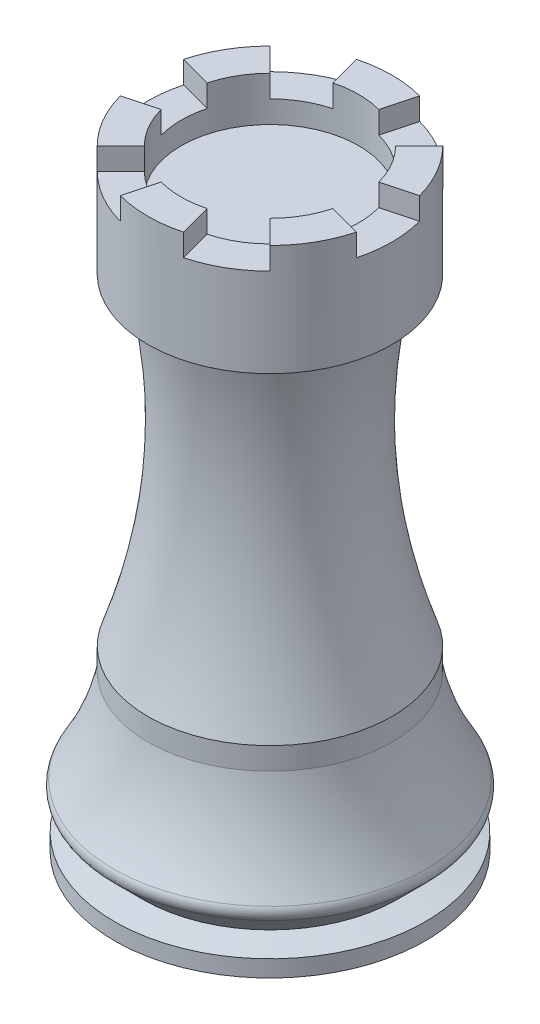
from build123d import *

# Parameters (mm, degrees)
FILLET1_R          = 1
SKETCH2_R          = 8
CUT_EXTRUDE1_DEPTH = 4
SKETCH3_W          = 3
SKETCH3_H          = 2
CUT_REVOLVE1_ANGLE = 30
CIRPATTERN1_COUNT  = 6


with BuildPart() as part:
    # Sketch1 → Revolve1 (revolve)
    with BuildSketch(Plane.XY, mode=Mode.PRIVATE) as revolve1_sk:
        with BuildLine():
            Line((0, 0), (14, 0))
            Line((14, 0), (14, 1.5))
            Line((14, 1.5), (11.449688693, 1.949688693))
            Line((11.449688693, 1.949688693), (14.5, 5))
            add(Edge.make_bspline(
                [(11, 14), (11.868897118, 9.149631339), (14.5, 5)],
                knots=[0, 0, 0, 1, 1, 1], degree=2))
            Line((11, 14), (11, 16))
            add(Edge.make_bspline(
                [(9, 44), (6.119153374, 30.160071278), (11, 16)],
                knots=[0, 0, 0, 1, 1, 1], degree=2))
            Line((9, 44), (11, 45))
            Line((11, 45), (11, 55))
            Line((11, 55), (0, 55))
            Line((0, 55), (0, 0))
        make_face()
    revolve(revolve1_sk.sketch.rotate(Axis((0, 55, 0), (0, -1, 0)), 180), axis=Axis((0, 55, 0), (0, -1, 0)))

    # Fillet1
    fillet1_edges = [part.edges().sort_by_distance(p)[0] for p in [
        (14.5, 5, 0),
    ]]
    fillet(fillet1_edges, radius=FILLET1_R)

    # Sketch2 → Cut-Extrude1 (cut)
    with BuildSketch(Plane(origin=(0, 55, 0), x_dir=(1, 0, 0), z_dir=(0, 1, 0))):
        with Locations(Location((0, 0, 0), (0, 0, 180))):
            Circle(SKETCH2_R)
    extrude(amount=-CUT_EXTRUDE1_DEPTH, mode=Mode.SUBTRACT)

    # Sketch3 → Cut-Revolve1 (revolve, symmetric, cut)
    with BuildSketch(Plane.XY) as cut_revolve1_sk:
        with Locations((9.5, 54)):
            Rectangle(SKETCH3_W, SKETCH3_H)
    cut_revolve1 = revolve(axis=Axis((0, 0, 0), (0, 1, 0)), revolution_arc=CUT_REVOLVE1_ANGLE / 2, mode=Mode.SUBTRACT)
    cut_revolve1 = cut_revolve1 + revolve(cut_revolve1_sk.sketch, axis=Axis((0, 0, 0), (0, -1, 0)), revolution_arc=CUT_REVOLVE1_ANGLE / 2, mode=Mode.SUBTRACT)

    # CirPattern1: Cut-Revolve1 ×6 about axis
    cirpattern1_axis = Axis((0, 0, 0), (0, 1, 0))
    for i in range(1, CIRPATTERN1_COUNT):
        add(cut_revolve1.rotate(cirpattern1_axis, i * 360 / CIRPATTERN1_COUNT), mode=Mode.SUBTRACT)


solid = part.part
